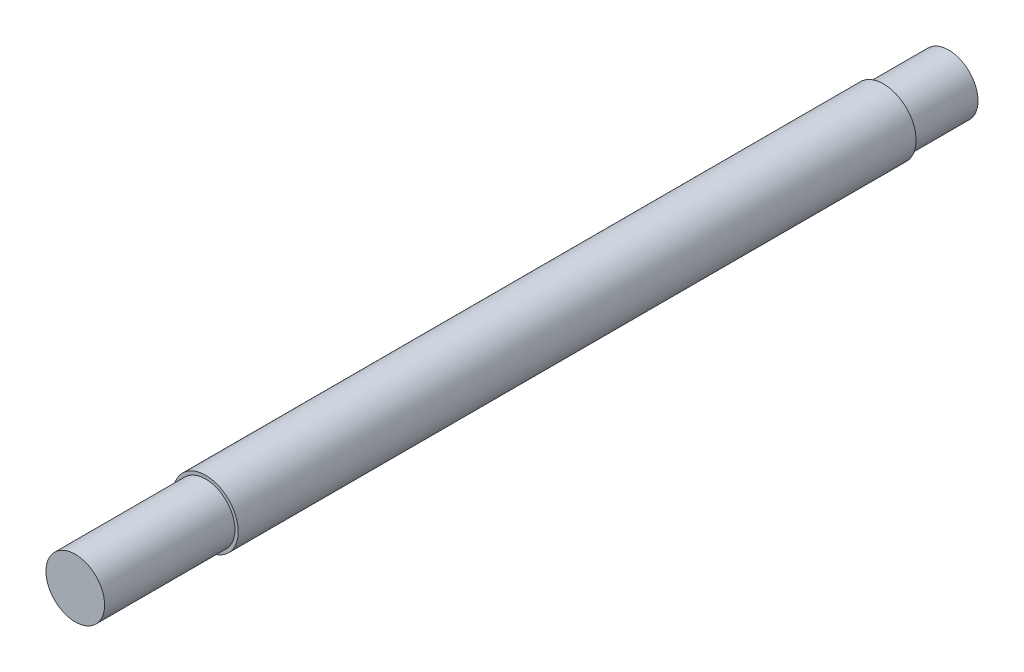
from build123d import *

# Parameters (mm, degrees)
SKETCH_1_R      = 5
EXTRUDE_1_DEPTH = 52
SKETCH_2_R      = 4.5
EXTRUDE_2_DEPTH = 10
EXTRUDE_START   = 20
SKETCH_3_R      = 4.5
EXTRUDE_3_DEPTH = 20


with BuildPart() as part:
    # 草图1 → 凸台-拉伸1 (new, symmetric)
    with BuildSketch(Plane.XY):
        with Locations(Location((0, 0, 0), (0, 0, 180))):
            Circle(SKETCH_1_R)
    extrude(amount=EXTRUDE_1_DEPTH, both=True)

    # 草图2 → 凸台-拉伸2 (add)
    with BuildSketch(Plane(origin=(0, 0, -52), x_dir=(-1, 0, 0), z_dir=(0, 0, -1))):
        with Locations(Location((0, 0, 0), (0, 0, 180))):
            Circle(SKETCH_2_R)
    extrude(amount=EXTRUDE_2_DEPTH)

    # 草图3 → 凸台-拉伸3 (add)
    with BuildSketch(Plane.XY.offset(52).offset(EXTRUDE_START)):
        Circle(SKETCH_3_R)
    extrude(amount=-EXTRUDE_3_DEPTH)


solid = part.part
